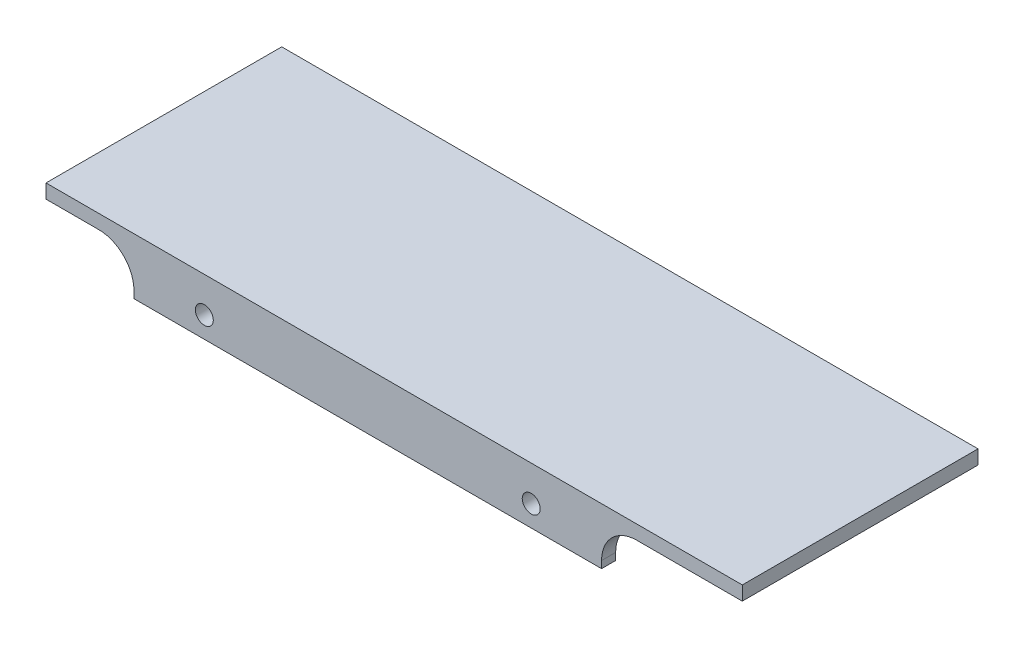
from build123d import *

# Parameters (mm, degrees)
SKETCH1_W           = 132.917449813
SKETCH1_H           = 12
SKETCH1_R           = 2.55
BOSS_EXTRUDE1_DEPTH = 4
SKETCH2_W           = 197.917449813
SKETCH2_H           = 67
BOSS_EXTRUDE2_DEPTH = 4
BOSS_EXTRUDE3_START = 4
SKETCH3_W           = 132.917449813
SKETCH3_H           = 12
SKETCH3_R           = 2.55
BOSS_EXTRUDE3_DEPTH = 4
FILLET1_R           = 10
FILLET2_R           = 2.5


with BuildPart() as part:
    # Sketch1 → Boss-Extrude1 (new body)
    with BuildSketch(Plane.XY):
        with Locations((-116.458724907, 49.8)):
            Rectangle(SKETCH1_W, SKETCH1_H)
        with Locations((-162.917449813, 49.8)):
            Circle(SKETCH1_R, mode=Mode.SUBTRACT)
        with Locations((-70, 49.8)):
            Circle(SKETCH1_R, mode=Mode.SUBTRACT)
    extrude(amount=BOSS_EXTRUDE1_DEPTH)

    # Sketch2 → Boss-Extrude2 (add)
    with BuildSketch(Plane(origin=(0, 55.8, 0), x_dir=(1, 0, 0), z_dir=(0, 1, 0))):
        with Locations((-108.958724907, -33.5)):
            Rectangle(SKETCH2_W, SKETCH2_H)
    extrude(amount=BOSS_EXTRUDE2_DEPTH)

    # Sketch3 → Boss-Extrude3 (add)
    with BuildSketch(Plane(origin=(0, 0, 67), x_dir=(-1, 0, 0), z_dir=(0, 0, -1)).offset(BOSS_EXTRUDE3_START)):
        with Locations((116.458724907, 49.8)):
            Rectangle(SKETCH3_W, SKETCH3_H)
        with Locations(Location((162.917449813, 49.8, 0), (0, 0, 180))):
            Circle(SKETCH3_R, mode=Mode.SUBTRACT)
        with Locations(Location((70, 49.8, 0), (0, 0, 180))):
            Circle(SKETCH3_R, mode=Mode.SUBTRACT)
    extrude(amount=-BOSS_EXTRUDE3_DEPTH)

    # Fillet1
    fillet1_edges = [part.edges().sort_by_distance(p)[0] for p in [
        (-182.917449813, 55.8, 65),
        (-50, 55.8, 65),
        (-182.917449813, 55.8, 2),
        (-50, 55.8, 2),
    ]]
    fillet(fillet1_edges, radius=FILLET1_R)

    # Fillet2
    fillet2_edges = [part.edges().sort_by_distance(p)[0] for p in [
        (-116.458724906, 55.8, 4),
        (-116.458724906, 55.8, 63),
    ]]
    fillet(fillet2_edges, radius=FILLET2_R)


solid = part.part
